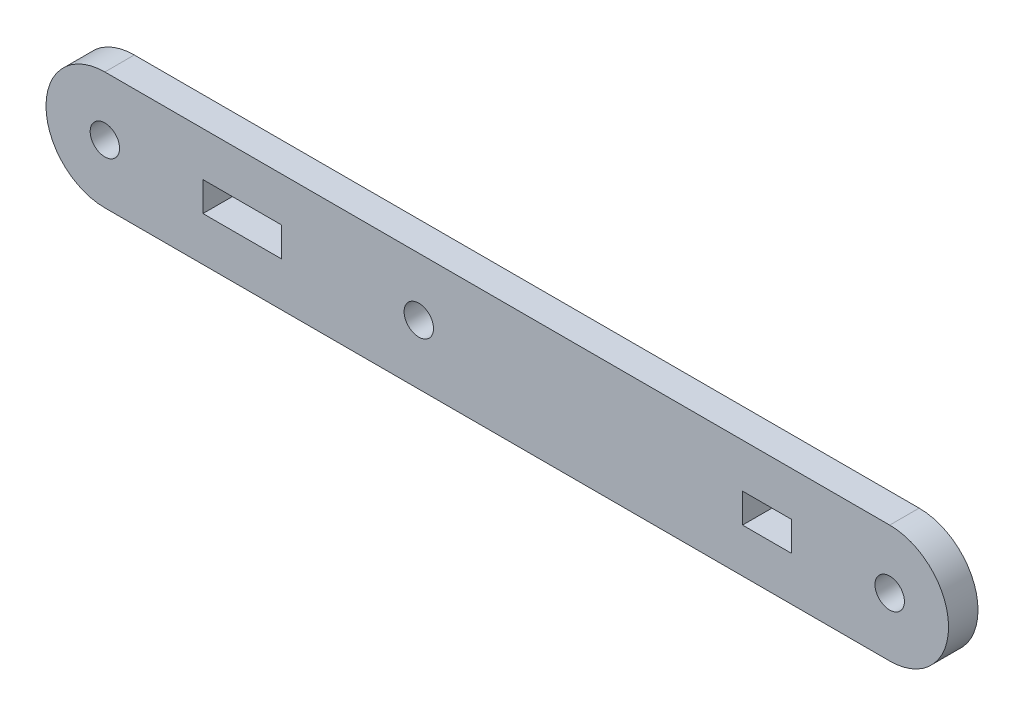
from build123d import *

# Parameters (mm, degrees)
ESQUISSE8_R        = 1.5
ESQUISSE8_W        = 8
ESQUISSE8_H        = 3
ESQUISSE8_W_2      = 5
BOSS_EXTRU_8_DEPTH = 3


with BuildPart() as part:
    # Esquisse8 → Boss.-Extru.8 (new body)
    with BuildSketch(Plane.XY):
        with BuildLine():
            Line((-62.973836854, -34.551748671), (17.026163146, -34.551748671))
            ThreePointArc((17.026163146, -34.551748671), (23.026163146, -40.551748671), (17.026163146, -46.551748671))
            Line((17.026163146, -46.551748671), (-62.973836854, -46.551748671))
            ThreePointArc((-62.973836854, -46.551748671), (-68.973836854, -40.551748671), (-62.973836854, -34.551748671))
        make_face()
        with Locations((-62.973836854, -40.551748671)):
            Circle(ESQUISSE8_R, mode=Mode.SUBTRACT)
        with Locations((-30.973836854, -40.457603156)):
            Circle(ESQUISSE8_R, mode=Mode.SUBTRACT)
        with Locations((17.026163146, -40.551748671)):
            Circle(ESQUISSE8_R, mode=Mode.SUBTRACT)
        with Locations((-48.973836854, -40.551748671)):
            Rectangle(ESQUISSE8_W, ESQUISSE8_H, mode=Mode.SUBTRACT)
        with Locations((4.526163146, -40.551748671)):
            Rectangle(ESQUISSE8_W_2, ESQUISSE8_H, mode=Mode.SUBTRACT)
    extrude(amount=BOSS_EXTRU_8_DEPTH)


solid = part.part
